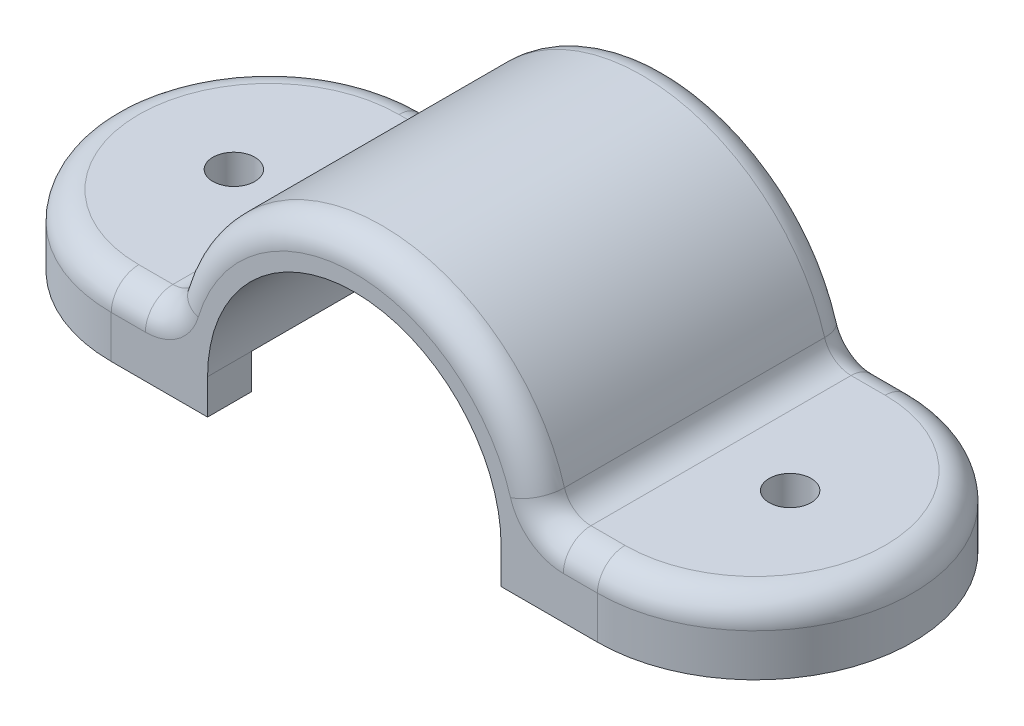
from build123d import *

# Parameters (mm, degrees)
BOSS_EXTRUDE1_DEPTH      = 22.86
BOSS_EXTRUDE8_DEPTH      = 2.54
BOSS_EXTRUDE8_DEPTH_BACK = 2.54
SKETCH9_W                = 3.175
SKETCH9_H                = 22.86
BOSS_EXTRUDE9_DEPTH      = 2.54
BOSS_EXTRUDE9_DEPTH_BACK = 2.54
SKETCH10_W               = 3.175
SKETCH10_H               = 22.86
BOSS_EXTRUDE10_DEPTH     = 3.81
BOSS_EXTRUDE11_DEPTH     = 3.81
REVOLVE1_ANGLE           = 180
REVOLVE2_ANGLE           = 180
SKETCH22_W               = 16.51
SKETCH22_H               = 2.54
CUT_EXTRUDE1_DEPTH       = 3.81
SKETCH23_W               = 16.51
SKETCH23_H               = 2.54
CUT_EXTRUDE2_DEPTH       = 3.81
SKETCH24_R               = 1.524
CUT_EXTRUDE3_DEPTH       = 3.81
FILLET1_R                = 2


with BuildPart() as part:
    # Sketch1 → Boss-Extrude1 (new body)
    with BuildSketch(Plane.XY):
        with BuildLine():
            Line((-13.8176, 0), (-10.6426, 0))
            ThreePointArc((-10.6426, 0), (0, 10.6426), (10.6426, 0))
            Line((10.6426, 0), (13.8176, 0))
            ThreePointArc((13.8176, 0), (0, 13.8176), (-13.8176, 0))
        make_face()
    extrude(amount=BOSS_EXTRUDE1_DEPTH)

    # Sketch9 → Boss-Extrude8 (add, two sides: drawn at the far end of the back side and taken through both)
    with BuildSketch(Plane.XZ.offset(-BOSS_EXTRUDE8_DEPTH_BACK)):
        with Locations((-12.2301, 11.43)):
            Rectangle(SKETCH9_W, SKETCH9_H)
    extrude(amount=BOSS_EXTRUDE8_DEPTH + BOSS_EXTRUDE8_DEPTH_BACK)

    # Sketch10 → Boss-Extrude9 (add, two sides: drawn at the far end of the back side and taken through both)
    with BuildSketch(Plane.XZ.offset(-BOSS_EXTRUDE9_DEPTH_BACK)):
        with Locations((12.2301, 11.43)):
            Rectangle(SKETCH10_W, SKETCH10_H)
    extrude(amount=BOSS_EXTRUDE9_DEPTH + BOSS_EXTRUDE9_DEPTH_BACK)

    # Sketch11 → Boss-Extrude10 (add)
    with BuildSketch(Plane.ZY.offset(13.8176)):
        Polygon((22.86, 2.54), (0, 2.54), (0, 0), (0, -2.54), (3.175, -2.54), (3.175, 0), (19.685, 0), (19.685, -2.54), (22.86, -2.54), align=None)
    extrude(amount=BOSS_EXTRUDE10_DEPTH)

    # Sketch19 → Boss-Extrude11 (add)
    with BuildSketch(Plane(origin=(13.8176, 0, 0), x_dir=(0, 0, -1), z_dir=(1, 0, 0))):
        Polygon((-19.685, -2.54), (-19.685, 0), (-3.175, 0), (-3.175, -2.54), (0, -2.54), (0, 2.54), (-22.86, 2.54), (-22.86, -2.54), align=None)
    extrude(amount=BOSS_EXTRUDE11_DEPTH)

    # Sketch20 → Revolve1 (revolve)
    with BuildSketch(Plane.ZY.offset(17.6276)):
        Polygon((11.43, 2.54), (11.43, 0), (19.685, 0), (19.685, -2.54), (22.86, -2.54), (22.86, 2.54), align=None)
    revolve(axis=Axis((-17.6276, 2.54, 11.43), (0, -1, 0)), revolution_arc=REVOLVE1_ANGLE)

    # Sketch21 → Revolve2 (revolve)
    with BuildSketch(Plane(origin=(17.6276, 0, 0), x_dir=(0, 0, -1), z_dir=(1, 0, 0))):
        Polygon((-11.43, 2.54), (-11.43, 0), (-3.175, 0), (-3.175, -2.54), (0, -2.54), (0, 2.54), align=None)
    revolve(axis=Axis((17.6276, 2.54, 11.43), (0, -1, 0)), revolution_arc=REVOLVE2_ANGLE)

    # Sketch22 → Cut-Extrude1 (cut)
    with BuildSketch(Plane.ZY.offset(13.8176)):
        with Locations((11.43, -1.27)):
            Rectangle(SKETCH22_W, SKETCH22_H)
    extrude(amount=-CUT_EXTRUDE1_DEPTH, mode=Mode.SUBTRACT)

    # Sketch23 → Cut-Extrude2 (cut)
    with BuildSketch(Plane(origin=(13.8176, 0, 0), x_dir=(0, 0, -1), z_dir=(1, 0, 0))):
        with Locations((-11.43, -1.27)):
            Rectangle(SKETCH23_W, SKETCH23_H)
    extrude(amount=-CUT_EXTRUDE2_DEPTH, mode=Mode.SUBTRACT)

    # Sketch24 → Cut-Extrude3 (cut)
    with BuildSketch(Plane(origin=(0, 2.54, 0), x_dir=(1, 0, 0), z_dir=(0, 1, 0))):
        with Locations((-20.1676, -11.43)):
            Circle(SKETCH24_R)
        with Locations((20.1676, -11.43)):
            Circle(SKETCH24_R)
    extrude(amount=-CUT_EXTRUDE3_DEPTH, mode=Mode.SUBTRACT)

    # Fillet1
    fillet1_edges = [part.edges().sort_by_distance(p)[0] for p in [
        (0, 13.8176, 0),
        (0, 13.8176, 22.86),
        (15.604868947, 2.54, 22.86),
        (15.604868947, 2.54, 0),
        (-15.604868947, 2.54, 0),
        (-15.604868947, 2.54, 22.86),
        (13.582137894, 2.54, 11.43),
        (-13.582137894, 2.54, 11.43),
        (29.0576, 2.54, 11.43),
        (-29.0576, 2.54, 11.43),
    ]]
    fillet(fillet1_edges, radius=FILLET1_R)


solid = part.part
